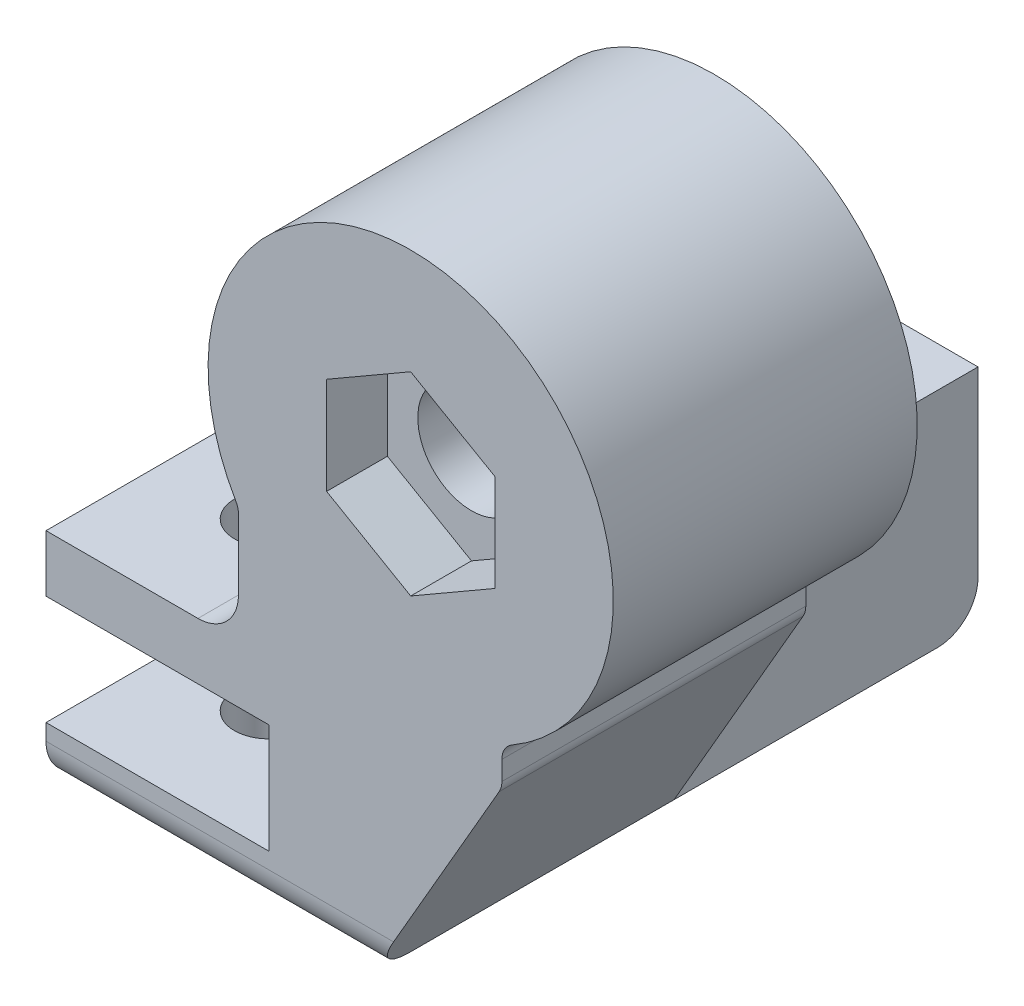
from build123d import *

# Parameters (mm, degrees)
EXTRUDE_1_DEPTH          = 30
SKETCH_3_R               = 2.65
EXTRUDE_2_DEPTH          = 15
SKETCH_4_R               = 5
CUT_EXTRUDE_1_DEPTH      = 5
CUT_EXTRUDE_2_DEPTH      = 3
CUT_EXTRUDE_3_DEPTH      = 47.097722286
CUT_EXTRUDE_3_DEPTH_BACK = 47.097722286
SKETCH_6_R               = 1.7
FILLET_1_R               = 2
FILLET_2_R               = 1
FILLET_3_R               = 1
FILLET_5_R               = 2


with BuildPart() as part:
    # 草图2 → 凸台-拉伸1 (new body)
    with BuildSketch(Plane.XY):
        Polygon((0, 0), (0, 2.8), (11, 2.8), (11, 8.2), (0, 8.2), (0, 11), (16, 11), (16, 0), align=None)
    extrude(amount=-EXTRUDE_1_DEPTH)

    # 草图3 → 凸台-拉伸2 (add)
    with BuildSketch(Plane.XY):
        with BuildLine():
            Line((9.5, 11), (9.5, 16.732173124))
            ThreePointArc((9.5, 16.732173124), (20.711715487, 31.625310339), (22.5, 13.06971445))
            Line((22.5, 13.06971445), (22.5, 11.258330249))
            Line((22.5, 11.258330249), (16, 0))
            Line((16, 0), (16, 11))
            Line((16, 11), (9.5, 11))
        make_face()
        with Locations((18, 22)):
            Circle(SKETCH_3_R, mode=Mode.SUBTRACT)
    extrude(amount=-EXTRUDE_2_DEPTH)

    # 草图4 → 切除-拉伸1 (cut)
    with BuildSketch(Plane(origin=(0, 0, -15), x_dir=(-1, 0, 0), z_dir=(0, 0, -1))):
        with Locations((-18, 22)):
            Circle(SKETCH_4_R)
    extrude(amount=-CUT_EXTRUDE_1_DEPTH, mode=Mode.SUBTRACT)

    # 草图5 → 切除-拉伸2 (cut)
    with BuildSketch(Plane.XY):
        Polygon((18, 26.792007234), (13.85, 24.396003617), (13.85, 19.603996383), (18, 17.207992766), (22.15, 19.603996383), (22.15, 24.396003617), align=None)
    extrude(amount=-CUT_EXTRUDE_2_DEPTH, mode=Mode.SUBTRACT)

    # 草图6 → 切除-拉伸3 (cut, two sides: drawn at the far end of the back side and taken through both)
    with BuildSketch(Plane(origin=(0, 11, 0), x_dir=(1, 0, 0), z_dir=(0, 1, 0)).offset(-CUT_EXTRUDE_3_DEPTH_BACK)):
        with Locations(Location((5, 6, 0), (0, 0, 180))):
            Circle(SKETCH_6_R)
        with Locations(Location((5, 24, 0), (0, 0, 180))):
            Circle(SKETCH_6_R)
    extrude(amount=CUT_EXTRUDE_3_DEPTH + CUT_EXTRUDE_3_DEPTH_BACK, mode=Mode.SUBTRACT)

    # 圆角1
    fillet_1_edges = [part.edges().sort_by_distance(p)[0] for p in [
        (9.5, 11, -7.5),
    ]]
    fillet(fillet_1_edges, radius=FILLET_1_R)

    # 圆角2
    fillet_2_edges = [part.edges().sort_by_distance(p)[0] for p in [
        (9.5, 16.732173124, -7.5),
    ]]
    fillet(fillet_2_edges, radius=FILLET_2_R)

    # 圆角3
    fillet_3_edges = [part.edges().sort_by_distance(p)[0] for p in [
        (22.5, 13.06971445, -7.5),
        (22.5, 11.258330249, -7.5),
    ]]
    fillet(fillet_3_edges, radius=FILLET_3_R)

    # 圆角5
    fillet_5_edges = [part.edges().sort_by_distance(p)[0] for p in [
        (8, 0, 0),
        (8, 0, -30),
    ]]
    fillet(fillet_5_edges, radius=FILLET_5_R)


solid = part.part
